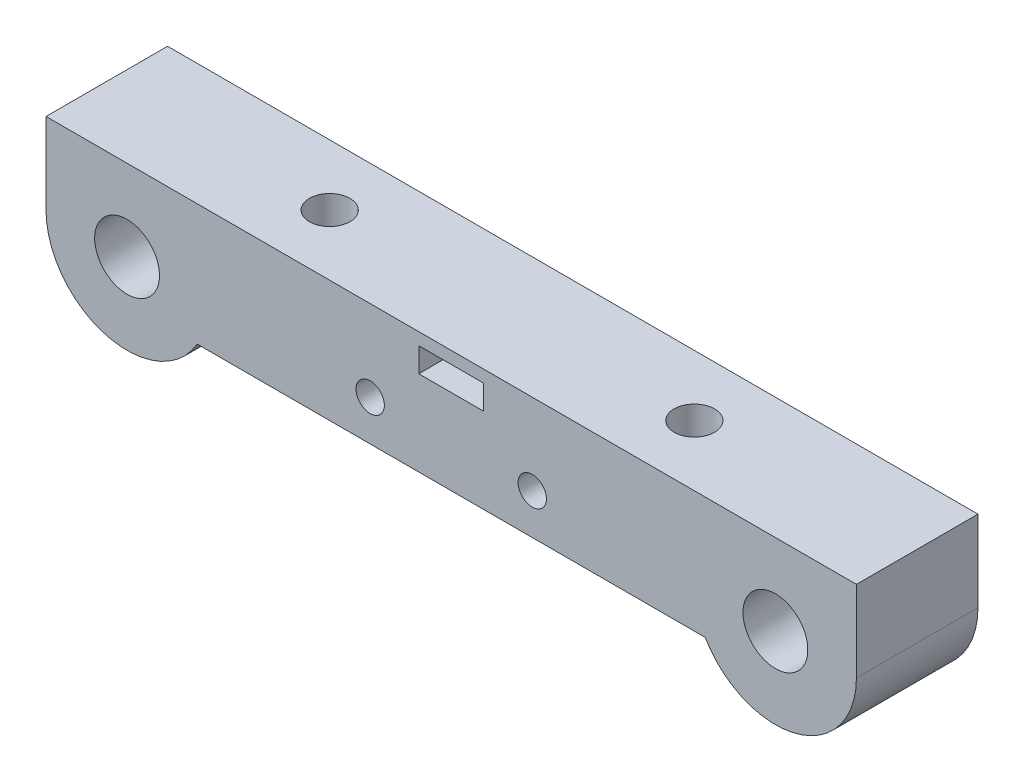
from build123d import *

# Parameters (mm, degrees)
ESBO_O1_R                = 4
ESBO_O1_R_2              = 1.75
ESBO_O1_W                = 8
ESBO_O1_H                = 3
RESSALTO_EXTRUS_O1_DEPTH = 15
ESBO_O2_R                = 2.5
CORTE_EXTRUS_O1_DEPTH    = 15


with BuildPart() as part:
    # Esboço1 → Ressalto-extrusão1 (new body)
    with BuildSketch(Plane.XY):
        with BuildLine():
            Line((50, 0), (50, -10))
            ThreePointArc((50, -10), (42.588190451, -19.659258263), (31.339745962, -15))
            Line((31.339745962, -15), (-31.339745962, -15))
            ThreePointArc((-31.339745962, -15), (-42.588190451, -19.659258263), (-50, -10))
            Line((-50, -10), (-50, 0))
            Line((-50, 0), (50, 0))
        make_face()
        with Locations((-40, -10)):
            Circle(ESBO_O1_R, mode=Mode.SUBTRACT)
        with Locations(Location((40, -10, 0), (0, 0, 180))):
            Circle(ESBO_O1_R, mode=Mode.SUBTRACT)
        with Locations((10, -10)):
            Circle(ESBO_O1_R_2, mode=Mode.SUBTRACT)
        with Locations((-10, -10)):
            Circle(ESBO_O1_R_2, mode=Mode.SUBTRACT)
        with Locations((0, -3)):
            Rectangle(ESBO_O1_W, ESBO_O1_H, mode=Mode.SUBTRACT)
    extrude(amount=RESSALTO_EXTRUS_O1_DEPTH)

    # Esboço2 → Corte-extrusão1 (cut)
    with BuildSketch(Plane.XZ.offset(15)):
        with Locations((22.5, 7.5)):
            Circle(ESBO_O2_R)
        with Locations((-22.5, 7.5)):
            Circle(ESBO_O2_R)
    extrude(amount=-CORTE_EXTRUS_O1_DEPTH, mode=Mode.SUBTRACT)


solid = part.part
